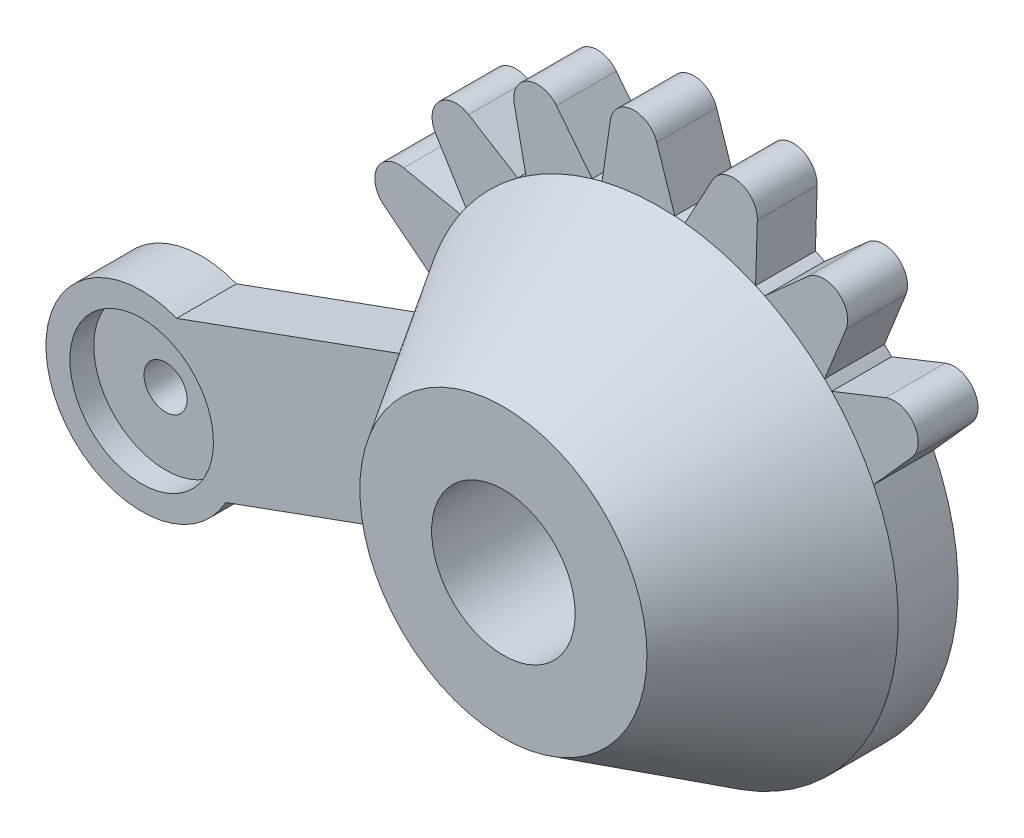
from build123d import *

# Parameters (mm, degrees)
CROQUIS1_R              = 10
SALIENTE_EXTRUIR1_DEPTH = 9
CHAFL_N1_SIZE           = 6.5
CHAFL_N1_SIZE2          = 4
SALIENTE_EXTRUIR3_DEPTH = 2.5
CROQUIS4_R              = 3
CORTAR_EXTRUIR1_DEPTH   = 186.864758197
CROQUIS5_R              = 3
CORTAR_EXTRUIR2_DEPTH   = 1
CROQUIS6_R              = 0.901496021
CORTAR_EXTRUIR3_DEPTH   = 16
SALIENTE_EXTRUIR4_DEPTH = 2.5


with BuildPart() as part:
    # Croquis1 → Saliente-Extruir1 (new body)
    with BuildSketch(Plane.XY):
        with Locations((-153.051797491, -38.56459666)):
            Circle(CROQUIS1_R)
    extrude(amount=SALIENTE_EXTRUIR1_DEPTH)

    # Chaflán1
    chafl_n1_edges = [part.edges().sort_by_distance(p)[0] for p in [
        (-163.051797491, -38.56459666, 9),
    ]]
    chafl_n1_side = [part.faces().sort_by_distance(p)[0] for p in [
        (-163.051797491, -38.56459666, 4.5),
    ]]
    chamfer(chafl_n1_edges, length=CHAFL_N1_SIZE, length2=CHAFL_N1_SIZE2, reference=chafl_n1_side[0])

    # Croquis3 → Saliente-Extruir3 (add)
    with BuildSketch(Plane(origin=(0, 0, 0), x_dir=(-1, 0, 0), z_dir=(0, 0, -1))):
        with BuildLine():
            Line((152.02722324, -41.384215004), (171.157627564, -48.335694708))
            ThreePointArc((171.157627564, -48.335694708), (178.428362583, -47.785764923), (173.206776067, -42.696458021))
            Line((173.206776067, -42.696458021), (154.076371743, -35.744978316))
            Line((154.076371743, -35.744978316), (152.02722324, -41.384215004))
        make_face()
    extrude(amount=-SALIENTE_EXTRUIR3_DEPTH)

    # Croquis4 → Cortar-Extruir1 (cut, through all)
    with BuildSketch(Plane.XY.offset(9)):
        with Locations((-153.051797491, -38.56459666)):
            Circle(CROQUIS4_R)
    extrude(amount=-CORTAR_EXTRUIR1_DEPTH, mode=Mode.SUBTRACT)

    # Croquis5 → Cortar-Extruir2 (cut)
    with BuildSketch(Plane.XY.offset(2.5)):
        with Locations((-174.668871458, -46.419665921)):
            Circle(CROQUIS5_R)
    extrude(amount=-CORTAR_EXTRUIR2_DEPTH, mode=Mode.SUBTRACT)

    # Croquis6 → Cortar-Extruir3 (cut)
    with BuildSketch(Plane.XY.offset(1.5)):
        with Locations((-174.668871458, -46.419665921)):
            Circle(CROQUIS6_R)
    extrude(amount=-CORTAR_EXTRUIR3_DEPTH, mode=Mode.SUBTRACT)

    # Croquis7 → Saliente-Extruir4 (add)
    with BuildSketch(Plane(origin=(0, 0, 0), x_dir=(-1, 0, 0), z_dir=(0, 0, -1))):
        with BuildLine():
            Line((142.472154892, -32.352593723), (144.077837211, -34.152336821))
            ThreePointArc((144.077837211, -34.152336821), (144.857254661, -32.833151134), (145.829058872, -31.648525027))
            Line((145.829058872, -31.648525027), (143.587737332, -30.757588058))
            ThreePointArc((143.587737332, -30.757588058), (142.398891813, -31.113717477), (142.472154892, -32.352593723))
        make_face()
        with BuildLine():
            Line((145.234815545, -29.108772462), (146.128114979, -31.349153467))
            ThreePointArc((146.128114979, -31.349153467), (147.223071886, -30.438960819), (148.436199285, -29.693505791))
            ThreePointArc((148.436199285, -29.693505791), (148.532872379, -29.643872708), (148.63007912, -29.595293084))
            Line((148.63007912, -29.595293084), (146.828644198, -27.991509074))
            ThreePointArc((146.828644198, -27.991509074), (145.589691401, -27.919552146), (145.234815545, -29.108772462))
        make_face()
        with BuildLine():
            Line((148.940319587, -27.005463152), (149.013491041, -29.416259051))
            ThreePointArc((149.013491041, -29.416259051), (150.353718186, -28.935455054), (151.748645686, -28.649870472))
            ThreePointArc((151.748645686, -28.649870472), (151.856464194, -28.636294775), (151.964423861, -28.623891525))
            Line((151.964423861, -28.623891525), (150.820155195, -26.500700496))
            ThreePointArc((150.820155195, -26.500700496), (149.680531113, -26.009336288), (148.940319587, -27.005463152))
        make_face()
        with BuildLine():
            ThreePointArc((155.218271428, -28.802097457), (155.324230846, -28.826216577), (155.42992191, -28.851485714))
            Line((155.42992191, -28.851485714), (155.080835189, -26.464975839))
            ThreePointArc((155.080835189, -26.464975839), (154.177995305, -25.613470127), (153.141728543, -26.296355938))
            Line((153.141728543, -26.296355938), (152.38594646, -28.586789165))
            ThreePointArc((152.38594646, -28.586789165), (153.366736356, -28.569557215), (154.344495765, -28.648502108))
            ThreePointArc((154.344495765, -28.648502108), (154.783087756, -28.715605137), (155.218271428, -28.802097457))
        make_face()
        with BuildLine():
            ThreePointArc((158.426588439, -30.131825925), (158.517908498, -30.190730739), (158.608583057, -30.250624434))
            Line((158.608583057, -30.250624434), (159.09678329, -27.888644024))
            ThreePointArc((159.09678329, -27.888644024), (158.53962342, -26.779700963), (157.332290487, -27.066979615))
            Line((157.332290487, -27.066979615), (155.83871334, -28.96079012))
            ThreePointArc((155.83871334, -28.96079012), (156.766248042, -29.280047284), (157.6580406, -29.688644631))
            ThreePointArc((157.6580406, -29.688644631), (158.047231669, -29.901708148), (158.426588439, -30.131825925))
        make_face()
        with BuildLine():
            ThreePointArc((160.986626339, -32.478670998), (161.052292491, -32.565256717), (161.117013855, -32.652550905))
            Line((161.117013855, -32.652550905), (162.38361689, -30.599989658))
            ThreePointArc((162.38361689, -30.599989658), (162.239338735, -29.367364148), (161.006561803, -29.224385594))
            Line((161.006561803, -29.224385594), (158.955337038, -30.493151881))
            ThreePointArc((158.955337038, -30.493151881), (159.717742172, -31.110391034), (160.416004535, -31.799357964))
            ThreePointArc((160.416004535, -31.799357964), (160.708852496, -32.132683364), (160.986626339, -32.478670998))
        make_face()
        with BuildLine():
            ThreePointArc((162.589606773, -35.559568525), (162.621698713, -35.663391632), (162.652660529, -35.767557347))
            Line((162.652660529, -35.767557347), (164.544895347, -34.271984441))
            ThreePointArc((164.544895347, -34.271984441), (164.830900984, -33.06434931), (163.721371142, -32.508358875))
            Line((163.721371142, -32.508358875), (161.35990674, -32.999049004))
            ThreePointArc((161.35990674, -32.999049004), (161.865224995, -33.839821995), (162.285736417, -34.726058929))
            ThreePointArc((162.285736417, -34.726058929), (162.446919484, -35.139442249), (162.589606773, -35.559568525))
        make_face()
    extrude(amount=-SALIENTE_EXTRUIR4_DEPTH)


solid = part.part
